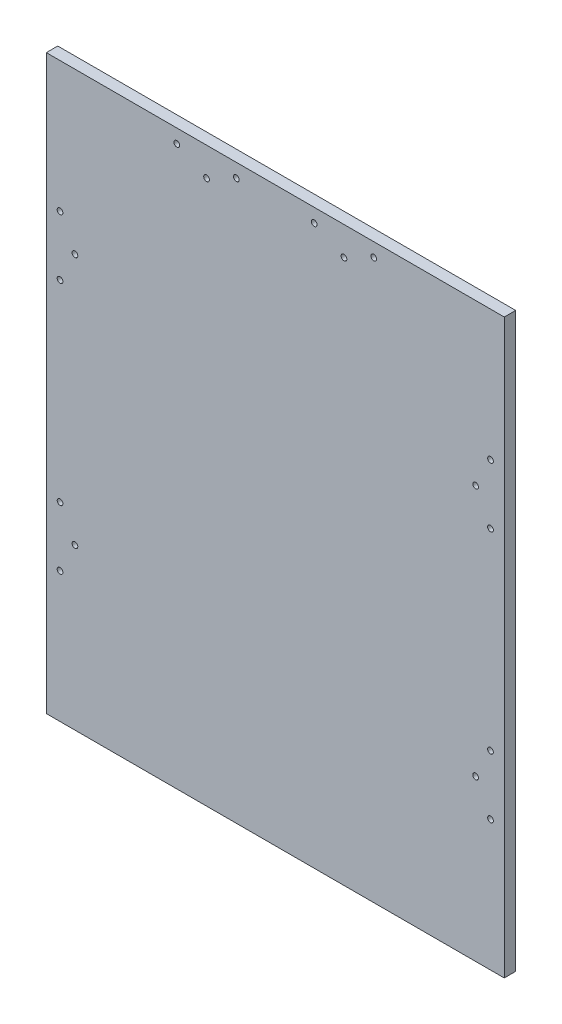
from build123d import *

# Parameters (mm, degrees)
SKETCH1_W           = 400
SKETCH1_H           = 500
BOSS_EXTRUDE1_DEPTH = 10
SKETCH2_R           = 2.5
CUT_EXTRUDE1_DEPTH  = 321.312347561
SKETCH3_R           = 2.5
CUT_EXTRUDE2_DEPTH  = 10


with BuildPart() as part:
    # Sketch1 → Boss-Extrude1 (new body)
    with BuildSketch(Plane.XY):
        Rectangle(SKETCH1_W, SKETCH1_H)
    extrude(amount=BOSS_EXTRUDE1_DEPTH)

    # Sketch2 → Cut-Extrude1 (cut, through all)
    with BuildSketch(Plane.XY.offset(10)):
        with Locations((-188, -136)):
            Circle(SKETCH2_R)
        with Locations((-175, -110)):
            Circle(SKETCH2_R)
        with Locations((-188, -84)):
            Circle(SKETCH2_R)
        with Locations((-188, 136)):
            Circle(SKETCH2_R)
        with Locations((-175, 110)):
            Circle(SKETCH2_R)
        with Locations((-188, 84)):
            Circle(SKETCH2_R)
        with Locations((-86, 238)):
            Circle(SKETCH2_R)
        with Locations((-60, 225)):
            Circle(SKETCH2_R)
        with Locations((-34, 238)):
            Circle(SKETCH2_R)
        with Locations((34, 238)):
            Circle(SKETCH2_R)
        with Locations((60, 225)):
            Circle(SKETCH2_R)
        with Locations((86, 238)):
            Circle(SKETCH2_R)
        with Locations((175, 110)):
            Circle(SKETCH2_R)
        with Locations((188, 136)):
            Circle(SKETCH2_R)
        with Locations((188, 84)):
            Circle(SKETCH2_R)
        with Locations((188, -84)):
            Circle(SKETCH2_R)
        with Locations((175, -110)):
            Circle(SKETCH2_R)
        with Locations((188, -136)):
            Circle(SKETCH2_R)
    extrude(amount=-CUT_EXTRUDE1_DEPTH, mode=Mode.SUBTRACT)

    # Sketch3 → Cut-Extrude2 (cut)
    with BuildSketch(Plane.XZ.offset(250)):
        with Locations((-20.25, 5)):
            Circle(SKETCH3_R)
        with Locations((20.25, 5)):
            Circle(SKETCH3_R)
    extrude(amount=-CUT_EXTRUDE2_DEPTH, mode=Mode.SUBTRACT)


solid = part.part
